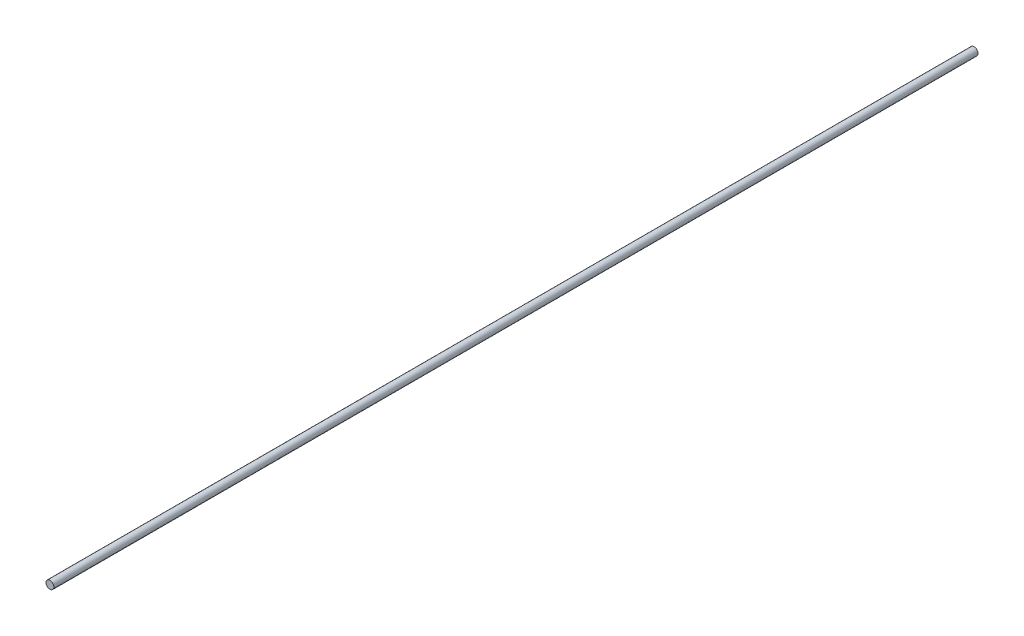
from build123d import *

# Parameters (mm, degrees)
SKIZZE1_R                       = 4
AUFSATZ_LINEAR_AUSTRAGEN1_DEPTH = 944.85


with BuildPart() as part:
    # Skizze1 → Aufsatz-Linear austragen1 (new body)
    with BuildSketch(Plane.XY):
        Circle(SKIZZE1_R)
    extrude(amount=AUFSATZ_LINEAR_AUSTRAGEN1_DEPTH)


solid = part.part
